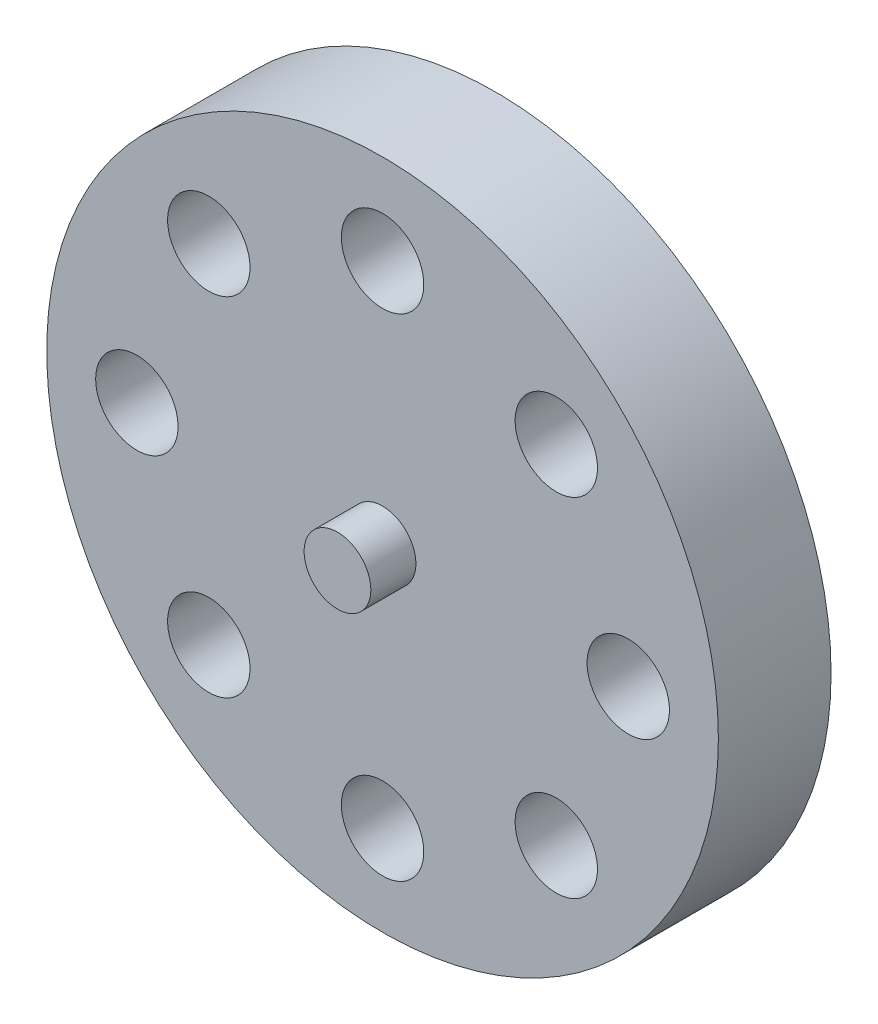
from build123d import *

# Parameters (mm, degrees)
SKETCH1_R           = 37.843146067
BOSS_EXTRUDE1_DEPTH = 12.7
SKETCH2_R           = 3.759495298
BOSS_EXTRUDE2_DEPTH = 5.08
SKETCH4_R           = 4.642939976
CUT_EXTRUDE1_DEPTH  = 56.00452171
CIRPATTERN1_COUNT   = 8


with BuildPart() as part:
    # Sketch1 → Boss-Extrude1 (new body)
    with BuildSketch(Plane.XY):
        Circle(SKETCH1_R)
    extrude(amount=BOSS_EXTRUDE1_DEPTH)

    # Sketch2 → Boss-Extrude2 (add)
    with BuildSketch(Plane.XY.offset(12.7)):
        Circle(SKETCH2_R)
    extrude(amount=BOSS_EXTRUDE2_DEPTH)

    # Sketch4 → Cut-Extrude1 (cut, through all)
    with BuildSketch(Plane.XY.offset(12.7)):
        with Locations((27.688174832, 0)):
            Circle(SKETCH4_R)
    cut_extrude1 = extrude(amount=-CUT_EXTRUDE1_DEPTH, mode=Mode.SUBTRACT)

    # CirPattern1: Cut-Extrude1 ×8 about axis
    cirpattern1_axis = Axis((0, 0, 0), (0, 0, 1))
    for i in range(1, CIRPATTERN1_COUNT):
        add(cut_extrude1.rotate(cirpattern1_axis, i * 360 / CIRPATTERN1_COUNT), mode=Mode.SUBTRACT)


solid = part.part
